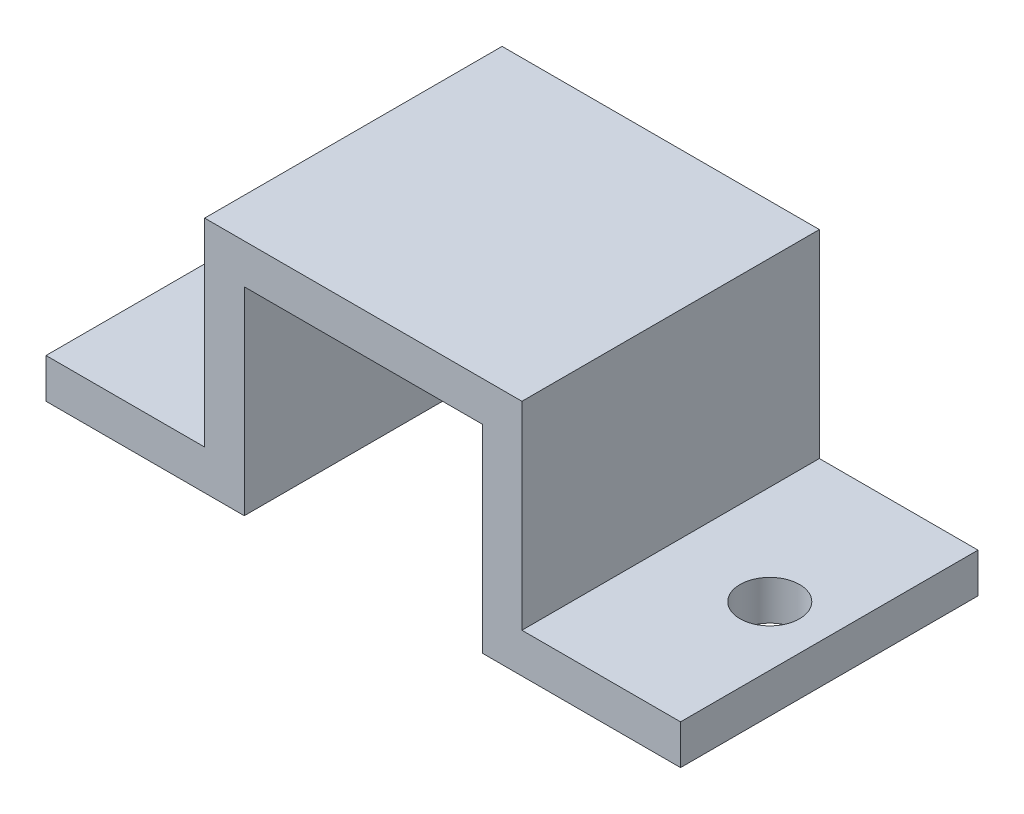
from build123d import *

# Parameters (mm, degrees)
BOSS_EXTRUDE1_DEPTH = 15
SKETCH2_R           = 1.5
CUT_EXTRUDE1_DEPTH  = 25.103941586


with BuildPart() as part:
    # Sketch1 → Boss-Extrude1 (new body)
    with BuildSketch(Plane.XY):
        Polygon((6, -6), (16, -6), (16, -4), (8, -4), (8, 6), (-8, 6), (-8, -4), (-16, -4), (-16, -6), (-6, -6), (-6, 4), (6, 4), align=None)
    extrude(amount=BOSS_EXTRUDE1_DEPTH)

    # Sketch2 → Cut-Extrude1 (cut, through all)
    with BuildSketch(Plane(origin=(0, -4, 0), x_dir=(1, 0, 0), z_dir=(0, 1, 0))):
        with Locations(Location((-13, -7.5, 0), (0, 0, 270))):
            Circle(SKETCH2_R)
        with Locations(Location((13, -7.5, 0), (0, 0, 270))):
            Circle(SKETCH2_R)
    extrude(amount=-CUT_EXTRUDE1_DEPTH, mode=Mode.SUBTRACT)


solid = part.part
